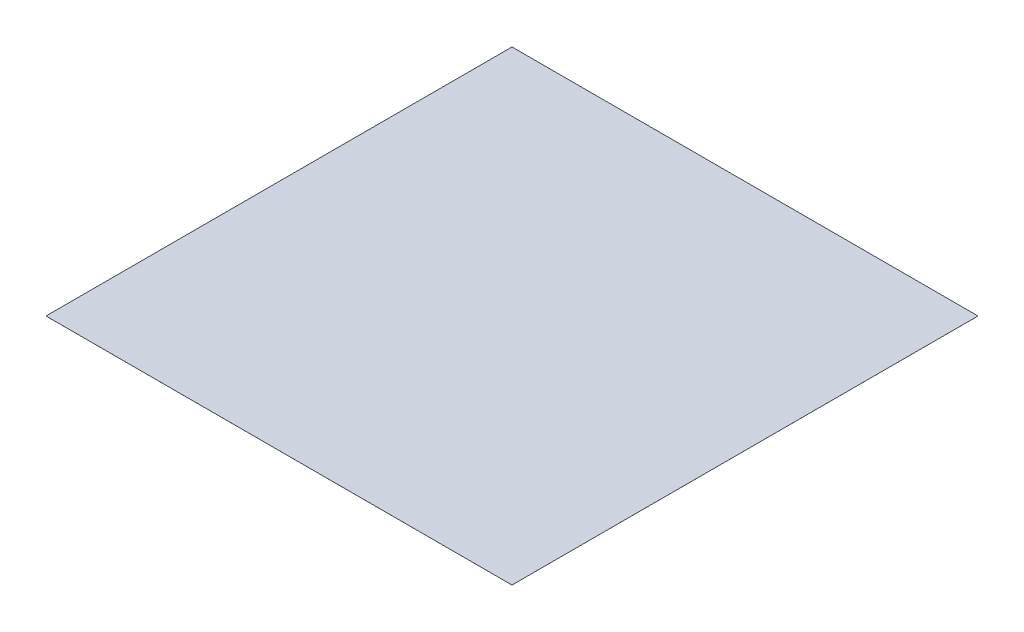
from build123d import *

# Parameters (mm, degrees)
SKETCH1_W           = 3000
SKETCH1_H           = 3000
BOSS_EXTRUDE1_DEPTH = 0.1


with BuildPart() as part:
    # Sketch1 → Boss-Extrude1 (new body)
    with BuildSketch(Plane(origin=(0, 0, 0), x_dir=(1, 0, 0), z_dir=(0, 1, 0))):
        Rectangle(SKETCH1_W, SKETCH1_H)
    extrude(amount=BOSS_EXTRUDE1_DEPTH)


solid = part.part
